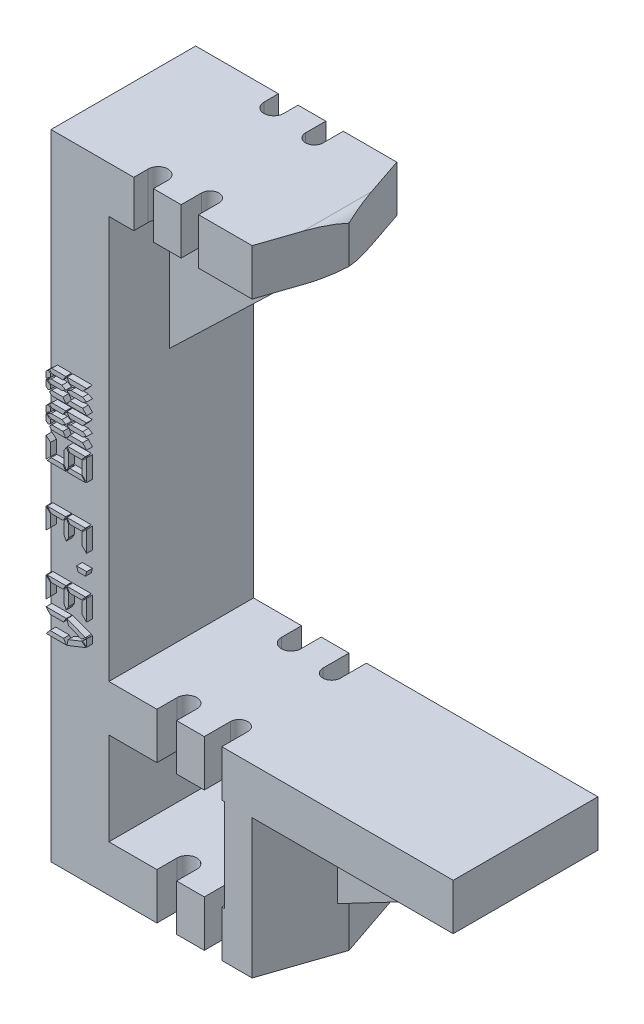
from build123d import *

# Parameters (mm, degrees)
BOSS_EXTRUDE2_DEPTH     = 12.5
BOSS_EXTRUDE3_DEPTH     = 25
CUT_EXTRUDE2_REACH      = 115.118
CUT_EXTRUDE3_REACH      = 115.118
BOSS_EXTRUDE5_DEPTH     = 2
FILLET7_R               = 3
CUT_EXTRUDE4_REACH      = 115.118
CUT_EXTRUDE6_REACH      = 115.118
SKETCH30_W              = 10
SKETCH30_H              = 25
CUT_EXTRUDE8_DEPTH      = 8
CUT_EXTRUDE9_DEPTH      = 83.489769669
CUT_EXTRUDE9_DEPTH_BACK = 83.489769669
BOSS_EXTRUDE6_DEPTH     = 1
BOSS_EXTRUDE7_DEPTH     = 40
BOSS_EXTRUDE17_DEPTH    = 2


with BuildPart() as part:
    # Sketch6 → Boss-Extrude2 (new, symmetric)
    with BuildSketch(Plane.XY):
        Polygon((-25, 54.805), (15, 54.805), (15, 46.805), (-15, 46.805), (-15, -46.805), (25, -46.805), (25, -54.805), (-25, -54.805), align=None)
    extrude(amount=BOSS_EXTRUDE2_DEPTH, both=True)

    # Sketch15 → Boss-Extrude3 (add)
    with BuildSketch(Plane.XY.offset(12.5)):
        Polygon((-15, -22.805), (15, -22.805), (15, -54.805), (5, -54.805), (5, -30.805), (-15, -30.805), align=None)
    extrude(amount=-BOSS_EXTRUDE3_DEPTH)

    # Sketch20 → Cut-Extrude2 (cut, up to next)
    with BuildSketch(Plane(origin=(0, 54.805, 0), x_dir=(1, 0, 0), z_dir=(0, 1, 0)), mode=Mode.PRIVATE) as cut_extrude2_sk1:
        with BuildLine():
            Line((-10.7, 12.5), (-10.7, 10))
            ThreePointArc((-10.7, 10), (-9, 8.3), (-7.3, 10))
            Line((-7.3, 10), (-7.3, 12.5))
            Line((-7.3, 12.5), (-10.7, 12.5))
        make_face()
    cut_extrude2_tool1 = extrude(cut_extrude2_sk1.sketch, amount=-CUT_EXTRUDE2_REACH, mode=Mode.PRIVATE) & part.part
    # Sketch20 → Cut-Extrude2 (cut, up to next)
    with BuildSketch(Plane(origin=(0, 54.805, 0), x_dir=(1, 0, 0), z_dir=(0, 1, 0)), mode=Mode.PRIVATE) as cut_extrude2_sk2:
        with BuildLine():
            Line((-7.3, -12.5), (-10.7, -12.5))
            Line((-10.7, -12.5), (-10.7, -10))
            ThreePointArc((-10.7, -10), (-9, -8.3), (-7.3, -10))
            Line((-7.3, -10), (-7.3, -12.5))
        make_face()
    cut_extrude2_tool2 = extrude(cut_extrude2_sk2.sketch, amount=-CUT_EXTRUDE2_REACH, mode=Mode.PRIVATE) & part.part
    add(cut_extrude2_tool1.solids().sort_by_distance((-9, 54.805, -10.563642))[0], mode=Mode.SUBTRACT)
    add(cut_extrude2_tool2.solids().sort_by_distance((-9, 54.805, 10.563642))[0], mode=Mode.SUBTRACT)

    # Cut-Extrude3: up to this face of the body (flat: up to its plane)
    cut_extrude3_end = Plane(part.part.faces().sort_by_distance((0, -22.805, 0))[0])
    # Sketch21 → Cut-Extrude3 (cut, up to the picked face)
    with BuildSketch(Plane.XZ.offset(54.805), mode=Mode.PRIVATE) as cut_extrude3_sk1:
        with BuildLine():
            Line((-6.7, 12.5), (-6.7, 9))
            ThreePointArc((-6.7, 9), (-5, 7.3), (-3.3, 9))
            Line((-3.3, 9), (-3.3, 12.5))
            Line((-3.3, 12.5), (-6.7, 12.5))
        make_face()
    cut_extrude3_tool1 = split(extrude(cut_extrude3_sk1.sketch, amount=-CUT_EXTRUDE3_REACH, mode=Mode.PRIVATE), bisect_by=cut_extrude3_end, keep=Keep.BOTH, mode=Mode.PRIVATE)
    # Sketch21 → Cut-Extrude3 (cut, up to the picked face)
    with BuildSketch(Plane.XZ.offset(54.805), mode=Mode.PRIVATE) as cut_extrude3_sk2:
        with BuildLine():
            Line((-3.3, -12.5), (-6.7, -12.5))
            Line((-6.7, -12.5), (-6.7, -9))
            ThreePointArc((-6.7, -9), (-5, -7.3), (-3.3, -9))
            Line((-3.3, -9), (-3.3, -12.5))
        make_face()
    cut_extrude3_tool2 = split(extrude(cut_extrude3_sk2.sketch, amount=-CUT_EXTRUDE3_REACH, mode=Mode.PRIVATE), bisect_by=cut_extrude3_end, keep=Keep.BOTH, mode=Mode.PRIVATE)
    add(cut_extrude3_tool1.solids().sort_by(Axis((-5, -54.805, 10.067524), (0, 1, 0)))[0], mode=Mode.SUBTRACT)
    add(cut_extrude3_tool2.solids().sort_by(Axis((-5, -54.805, -10.067524), (0, 1, 0)))[0], mode=Mode.SUBTRACT)

    # Sketch22 → Boss-Extrude5 (add, symmetric)
    with BuildSketch(Plane.XY):
        Polygon((-15, 21.805), (11, 46.805), (-15, 46.805), align=None)
    extrude(amount=BOSS_EXTRUDE5_DEPTH, both=True)

    # Fillet7
    fillet7_edges = [part.edges().sort_by_distance(p)[0] for p in [
        (15, 54.805, 0),
        (15, 46.805, 0),
    ]]
    fillet(fillet7_edges, radius=FILLET7_R)

    # Sketch23 → Cut-Extrude4 (cut, up to next)
    with BuildSketch(Plane(origin=(0, 54.805, 0), x_dir=(1, 0, 0), z_dir=(0, 1, 0)), mode=Mode.PRIVATE) as cut_extrude4_sk1:
        with BuildLine():
            Line((-2.51, 12.5), (-2.51, 9))
            ThreePointArc((-2.51, 9), (-1, 7.49), (0.51, 9))
            Line((0.51, 9), (0.51, 12.5))
            Line((0.51, 12.5), (-2.51, 12.5))
        make_face()
    cut_extrude4_tool1 = extrude(cut_extrude4_sk1.sketch, amount=-CUT_EXTRUDE4_REACH, mode=Mode.PRIVATE) & part.part
    # Sketch23 → Cut-Extrude4 (cut, up to next)
    with BuildSketch(Plane(origin=(0, 54.805, 0), x_dir=(1, 0, 0), z_dir=(0, 1, 0)), mode=Mode.PRIVATE) as cut_extrude4_sk2:
        with BuildLine():
            Line((0.51, -12.5), (-2.51, -12.5))
            Line((-2.51, -12.5), (-2.51, -9))
            ThreePointArc((-2.51, -9), (-1, -7.49), (0.51, -9))
            Line((0.51, -9), (0.51, -12.5))
        make_face()
    cut_extrude4_tool2 = extrude(cut_extrude4_sk2.sketch, amount=-CUT_EXTRUDE4_REACH, mode=Mode.PRIVATE) & part.part
    add(cut_extrude4_tool1.solids().sort_by_distance((-1, 54.805, -10.144905))[0], mode=Mode.SUBTRACT)
    add(cut_extrude4_tool2.solids().sort_by_distance((-1, 54.805, 10.144905))[0], mode=Mode.SUBTRACT)

    # Cut-Extrude6: up to this face of the body (flat: up to its plane)
    cut_extrude6_end = Plane(part.part.faces().sort_by_distance((0.229244521, -22.805, 0))[0])
    # Sketch24 → Cut-Extrude6 (cut, up to the picked face)
    with BuildSketch(Plane.XZ.offset(54.805), mode=Mode.PRIVATE) as cut_extrude6_sk1:
        with BuildLine():
            Line((1.49, -12.5), (1.49, -8))
            ThreePointArc((1.49, -8), (3, -6.49), (4.51, -8))
            Line((4.51, -8), (4.51, -12.5))
            Line((4.51, -12.5), (1.49, -12.5))
        make_face()
    cut_extrude6_tool1 = split(extrude(cut_extrude6_sk1.sketch, amount=-CUT_EXTRUDE6_REACH, mode=Mode.PRIVATE), bisect_by=cut_extrude6_end, keep=Keep.BOTH, mode=Mode.PRIVATE)
    # Sketch24 → Cut-Extrude6 (cut, up to the picked face)
    with BuildSketch(Plane.XZ.offset(54.805), mode=Mode.PRIVATE) as cut_extrude6_sk2:
        with BuildLine():
            Line((4.51, 12.5), (1.49, 12.5))
            Line((1.49, 12.5), (1.49, 8))
            ThreePointArc((1.49, 8), (3, 6.49), (4.51, 8))
            Line((4.51, 8), (4.51, 12.5))
        make_face()
    cut_extrude6_tool2 = split(extrude(cut_extrude6_sk2.sketch, amount=-CUT_EXTRUDE6_REACH, mode=Mode.PRIVATE), bisect_by=cut_extrude6_end, keep=Keep.BOTH, mode=Mode.PRIVATE)
    add(cut_extrude6_tool1.solids().sort_by(Axis((3, -54.805, -9.647036), (0, 1, 0)))[0], mode=Mode.SUBTRACT)
    add(cut_extrude6_tool2.solids().sort_by(Axis((3, -54.805, 9.647036), (0, 1, 0)))[0], mode=Mode.SUBTRACT)

    # Sketch30 → Cut-Extrude8 (cut)
    with BuildSketch(Plane(origin=(0, -46.805, 0), x_dir=(1, 0, 0), z_dir=(0, 1, 0))):
        with Locations((20, 0)):
            Rectangle(SKETCH30_W, SKETCH30_H)
    extrude(amount=-CUT_EXTRUDE8_DEPTH, mode=Mode.SUBTRACT)

    # Sketch34 → Cut-Extrude9 (cut, two sides: drawn at the far end of the back side and taken through both)
    with BuildSketch(Plane(origin=(0, -22.805, 0), x_dir=(1, 0, 0), z_dir=(0, 1, 0)).offset(-CUT_EXTRUDE9_DEPTH_BACK)):
        Polygon((9.755, 12.5), (14, 0), (9.755, -12.5), (15, -12.5), (15, 12.5), align=None)
    extrude(amount=CUT_EXTRUDE9_DEPTH + CUT_EXTRUDE9_DEPTH_BACK, mode=Mode.SUBTRACT)

    # Sketch35 → Boss-Extrude6 (add)
    with BuildSketch(Plane.XY.offset(12.5)):
        Polygon((-21.447222222, 20.125), (-21.933333333, 19.347222222), (-23.877777778, 19.347222222), (-24.266666667, 19.739149306), (-23.877777778, 20.125), align=None)
        Polygon((-17.85, 20.125), (-18.530555556, 19.347222222), (-20.766666667, 19.347222222), (-21.252777778, 20.125), align=None)
        Polygon((-24.85, 18.180555556), (-24.85, 19.25), (-24.464149306, 19.541666667), (-24.072222222, 19.25), (-24.072222222, 18.672743056), align=None)
        Polygon((-18.530555556, 18.472222222), (-17.85, 18.086371528), (-18.530555556, 17.694444444), (-20.669444444, 17.694444444), (-21.252777778, 18.086371528), (-20.572222222, 18.472222222), align=None)
        Polygon((-22.127777778, 17.694444444), (-23.975, 17.694444444), (-24.641883681, 18.086371528), (-23.975, 18.472222222), (-22.127777778, 18.472222222), (-21.447222222, 18.086371528), align=None)
        Polygon((-21.447222222, 16.041666667), (-23.877777778, 16.041666667), (-24.266666667, 16.43359375), (-23.877777778, 16.819444444), (-21.933333333, 16.819444444), align=None)
        Polygon((-17.85, 16.041666667), (-21.252777778, 16.041666667), (-20.766666667, 16.819444444), (-18.530555556, 16.819444444), align=None)
        Polygon((-24.85, 17.986111111), (-24.072222222, 17.493923611), (-24.072222222, 16.916666667), (-24.464149306, 16.625), (-24.85, 16.916666667), align=None)
        Polygon((-21.447222222, 14.972222222), (-21.933333333, 14.194444444), (-23.877777778, 14.194444444), (-24.266666667, 14.586371528), (-23.877777778, 14.972222222), align=None)
        Polygon((-17.85, 14.972222222), (-18.530555556, 14.194444444), (-20.766666667, 14.194444444), (-21.252777778, 14.972222222), align=None)
        Polygon((-24.85, 13.027777778), (-24.85, 14.097222222), (-24.464149306, 14.388888889), (-24.072222222, 14.097222222), (-24.072222222, 13.519965278), align=None)
        Polygon((-18.530555556, 13.319444444), (-17.85, 12.93359375), (-18.530555556, 12.541666667), (-20.669444444, 12.541666667), (-21.252777778, 12.93359375), (-20.572222222, 13.319444444), align=None)
        Polygon((-22.127777778, 12.541666667), (-23.975, 12.541666667), (-24.641883681, 12.93359375), (-23.975, 13.319444444), (-22.127777778, 13.319444444), (-21.447222222, 12.93359375), align=None)
        Polygon((-21.447222222, 10.888888889), (-23.877777778, 10.888888889), (-24.266666667, 11.280815972), (-23.877777778, 11.666666667), (-21.933333333, 11.666666667), align=None)
        Polygon((-17.85, 10.888888889), (-21.252777778, 10.888888889), (-20.766666667, 11.666666667), (-18.530555556, 11.666666667), align=None)
        Polygon((-24.85, 12.833333333), (-24.072222222, 12.341145833), (-24.072222222, 11.763888889), (-24.464149306, 11.472222222), (-24.85, 11.763888889), align=None)
        Polygon((-21.447222222, 5.930555556), (-24.655555556, 5.930555556), (-23.975, 6.708333333), (-21.933333333, 6.708333333), align=None)
        Polygon((-18.044444444, 5.930555556), (-21.252777778, 5.930555556), (-20.766666667, 6.708333333), (-18.725, 6.708333333), align=None)
        Polygon((-24.85, 9.625), (-24.072222222, 8.944444444), (-24.072222222, 6.805555556), (-24.85, 6.027777778), align=None)
        Polygon((-17.85, 9.722222222), (-17.85, 6.027777778), (-18.627777778, 6.805555556), (-18.627777778, 8.944444444), align=None)
        Polygon((-18.044444444, 9.819444444), (-18.725, 9.041666667), (-20.766666667, 9.041666667), (-21.190494792, 9.760199653), (-21.155555556, 9.819444444), align=None)
        Polygon((-21.353038194, 6.108289931), (-21.741927083, 6.805555556), (-21.741927083, 8.944444444), (-21.356076389, 9.527777778), (-20.964149306, 8.944444444), (-20.964149306, 6.805555556), align=None)
        Polygon((-24.85, -0.972222222), (-24.072222222, -1.75), (-24.072222222, -3.791666667), (-24.85, -4.569444444), align=None)
        Polygon((-17.85, -0.972222222), (-17.85, -4.569444444), (-18.627777778, -3.791666667), (-18.627777778, -1.75), align=None)
        Polygon((-21.252777778, -0.875), (-18.044444444, -0.875), (-18.725, -1.652777778), (-20.772743056, -1.652777778), align=None)
        Polygon((-24.655555556, -0.875), (-21.447222222, -0.875), (-21.927256944, -1.652777778), (-23.975, -1.652777778), align=None)
        Polygon((-21.356076389, -4.472222222), (-21.741927083, -3.791666667), (-21.741927083, -1.75), (-21.353038194, -1.052734375), (-20.964149306, -1.75), (-20.964149306, -3.791666667), align=None)
        Polygon((-19.595442708, -7.291666667), (-17.85, -7.291666667), (-18.038368056, -8.069444444), (-19.308333333, -8.069444444), align=None)
        Polygon((-24.85, -11.277777778), (-24.072222222, -12.055555556), (-24.072222222, -14.097222222), (-24.85, -14.875), align=None)
        Polygon((-17.85, -11.277777778), (-17.85, -14.875), (-18.627777778, -14.097222222), (-18.627777778, -12.055555556), align=None)
        Polygon((-21.252777778, -11.180555556), (-18.044444444, -11.180555556), (-18.725, -11.958333333), (-20.772743056, -11.958333333), align=None)
        Polygon((-24.655555556, -11.180555556), (-21.447222222, -11.180555556), (-21.927256944, -11.958333333), (-23.975, -11.958333333), align=None)
        Polygon((-21.356076389, -14.777777778), (-21.741927083, -14.097222222), (-21.741927083, -12.055555556), (-21.353038194, -11.358289931), (-20.964149306, -12.055555556), (-20.964149306, -14.097222222), align=None)
        Polygon((-21.030989583, -19.055555556), (-18.725, -18.131944444), (-17.947222222, -18.715277778), (-21.252777778, -20.027777778), align=None)
        Polygon((-17.85, -17.354166667), (-17.85, -18.618055556), (-18.530555556, -17.995225694), align=None)
        Polygon((-21.252777778, -16.041666667), (-18.044444444, -17.256944444), (-18.725, -17.840277778), (-20.989973958, -16.916666667), align=None)
        Polygon((-21.35, -20.027777778), (-24.85, -20.027777778), (-24.169444444, -19.25), (-21.836111111, -19.25), align=None)
        Polygon((-24.85, -16.041666667), (-21.35, -16.041666667), (-21.836111111, -16.819444444), (-24.169444444, -16.819444444), align=None)
    extrude(amount=BOSS_EXTRUDE6_DEPTH)

    # 3DSketch1 → Boss-Extrude7 (add)
    with BuildSketch(Plane(origin=(4.51, -22.805, 12.5), x_dir=(0, -0.304775727103784, -0.9524241471993241), z_dir=(-1, 0, 0))):
        Polygon((0, 0), (2.438205817, 7.619393178), (26.248809497, 0), (23.81060368, -7.619393178), align=None)
    extrude(amount=-BOSS_EXTRUDE7_DEPTH)


with BuildPart() as body_2:
    # Sketch37 → Boss-Extrude17 (new, symmetric)
    with BuildSketch(Plane.XY):
        Polygon((14, -30.805), (44.51, -30.805), (14, -46.805), align=None)
    extrude(amount=BOSS_EXTRUDE17_DEPTH, both=True)


solid = Compound([part.part, body_2.part])
